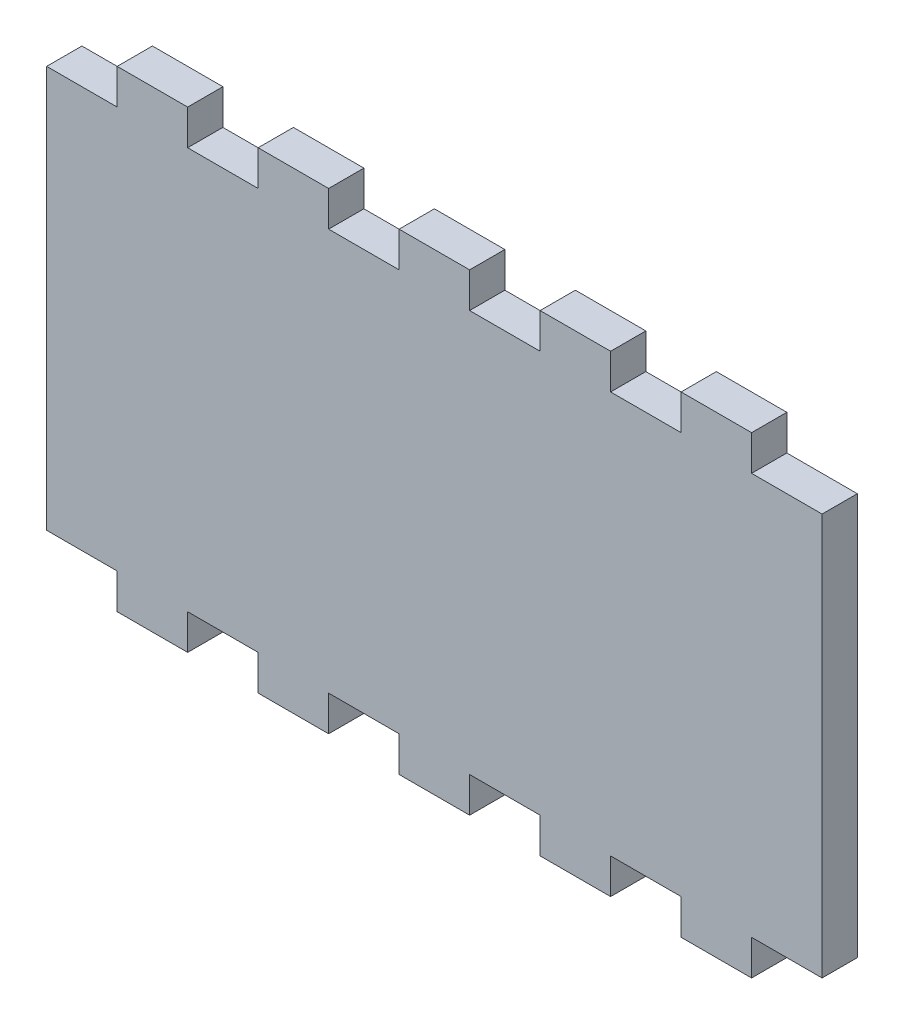
from build123d import *

# Parameters (mm, degrees)
BOSS_EXTRUDE1_DEPTH = 3.175


with BuildPart() as part:
    # Sketch1 → Boss-Extrude1 (new body)
    with BuildSketch(Plane.XY):
        Polygon((0, 3.175), (6.35, 3.175), (6.35, 0), (12.7, 0), (12.7, 3.175), (19.05, 3.175), (19.05, 0), (25.4, 0), (25.4, 3.175), (31.75, 3.175), (31.75, 0), (38.1, 0), (38.1, 3.175), (44.45, 3.175), (44.45, 0), (50.8, 0), (50.8, 3.175), (57.15, 3.175), (57.15, 0), (63.5, 0), (63.5, 3.175), (69.85, 3.175), (69.85, 39.37), (63.5, 39.37), (63.5, 42.545), (57.15, 42.545), (57.15, 39.37), (50.8, 39.37), (50.8, 42.545), (44.45, 42.545), (44.45, 39.37), (38.1, 39.37), (38.1, 42.545), (31.75, 42.545), (31.75, 39.37), (25.4, 39.37), (25.4, 42.545), (19.05, 42.545), (19.05, 39.37), (12.7, 39.37), (12.7, 42.545), (6.35, 42.545), (6.35, 39.37), (0, 39.37), align=None)
    extrude(amount=BOSS_EXTRUDE1_DEPTH)


solid = part.part
